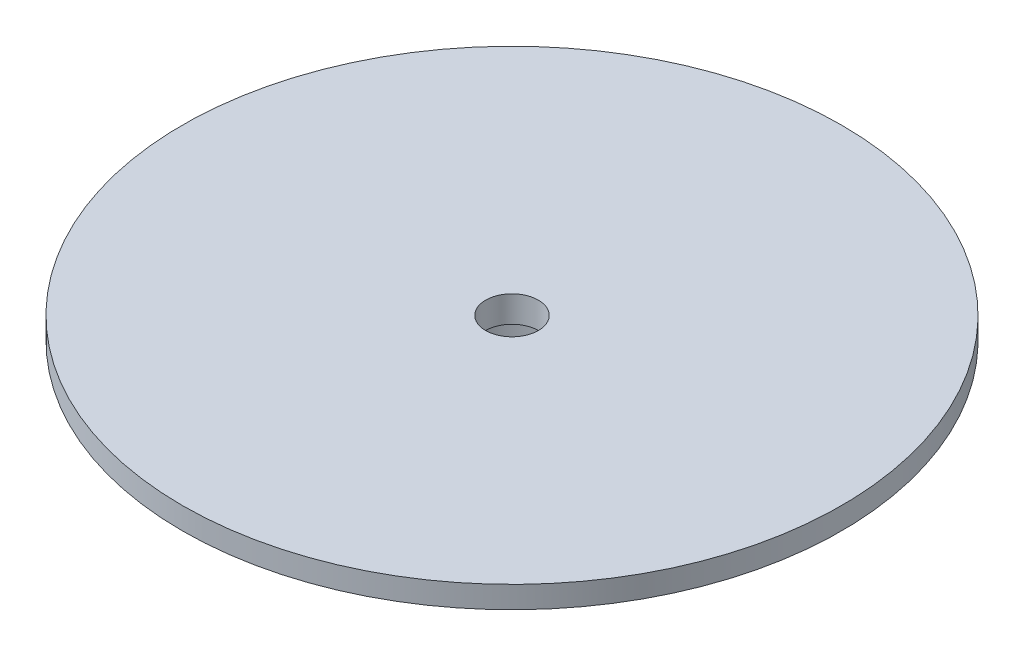
from build123d import *

# Parameters (mm, degrees)
ESQUISSE1_R             = 41
ESQUISSE1_R_2           = 6
BOSS_EXTRU_1_DEPTH      = 10
ESQUISSE2_R             = 17.5
ENL_V_MAT_EXTRU_1_DEPTH = 4
BOSS_EXTRU_2_START      = -5
ESQUISSE3_R             = 75
ESQUISSE3_R_2           = 6
BOSS_EXTRU_2_DEPTH      = 5
BOSS_EXTRU_3_START      = 6.83
ESQUISSE4_R             = 25
ESQUISSE4_R_2           = 17.5
BOSS_EXTRU_3_DEPTH      = 6.83


with BuildPart() as part:
    # Esquisse1 → Boss.-Extru.1 (new body)
    with BuildSketch(Plane(origin=(0, 0, 0), x_dir=(1, 0, 0), z_dir=(0, 1, 0))):
        with Locations(Location((0, 0, 0), (0, 0, 270))):
            Circle(ESQUISSE1_R)
        with Locations(Location((0, 0, 0), (0, 0, 270))):
            Circle(ESQUISSE1_R_2, mode=Mode.SUBTRACT)
    extrude(amount=BOSS_EXTRU_1_DEPTH)

    # Esquisse2 → Enlèv. mat.-Extru.1 (cut)
    with BuildSketch(Plane.XZ):
        with Locations(Location((0, 0, 0), (0, 0, 270))):
            Circle(ESQUISSE2_R)
    extrude(amount=-ENL_V_MAT_EXTRU_1_DEPTH, mode=Mode.SUBTRACT)

    # Esquisse3 → Boss.-Extru.2 (add)
    with BuildSketch(Plane(origin=(0, 10, 0), x_dir=(1, 0, 0), z_dir=(0, 1, 0)).offset(BOSS_EXTRU_2_START)):
        with Locations(Location((0, 0, 0), (0, 0, 270))):
            Circle(ESQUISSE3_R)
        with Locations(Location((0, 0, 0), (0, 0, 90))):
            Circle(ESQUISSE3_R_2, mode=Mode.SUBTRACT)
    extrude(amount=BOSS_EXTRU_2_DEPTH)

    # Esquisse4 → Boss.-Extru.3 (add)
    with BuildSketch(Plane.XZ.offset(BOSS_EXTRU_3_START)):
        with Locations(Location((0, 0, 0), (0, 0, 90))):
            Circle(ESQUISSE4_R)
        with Locations(Location((0, 0, 0), (0, 0, 270))):
            Circle(ESQUISSE4_R_2, mode=Mode.SUBTRACT)
    extrude(amount=-BOSS_EXTRU_3_DEPTH)


solid = part.part
